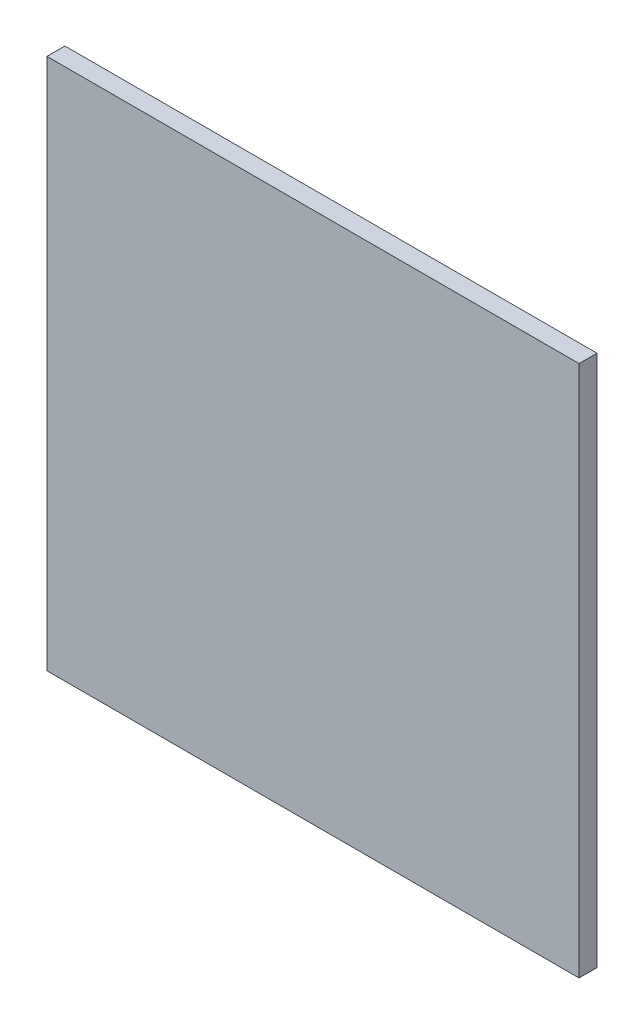
from build123d import *

# Parameters (mm, degrees)
CROQUIS1_W              = 80
CROQUIS1_H              = 80
SALIENTE_EXTRUIR1_DEPTH = 2.7


with BuildPart() as part:
    # Croquis1 → Saliente-Extruir1 (new body)
    with BuildSketch(Plane.XY):
        with Locations((-40, 42.7)):
            Rectangle(CROQUIS1_W, CROQUIS1_H)
    extrude(amount=-SALIENTE_EXTRUIR1_DEPTH)


solid = part.part
